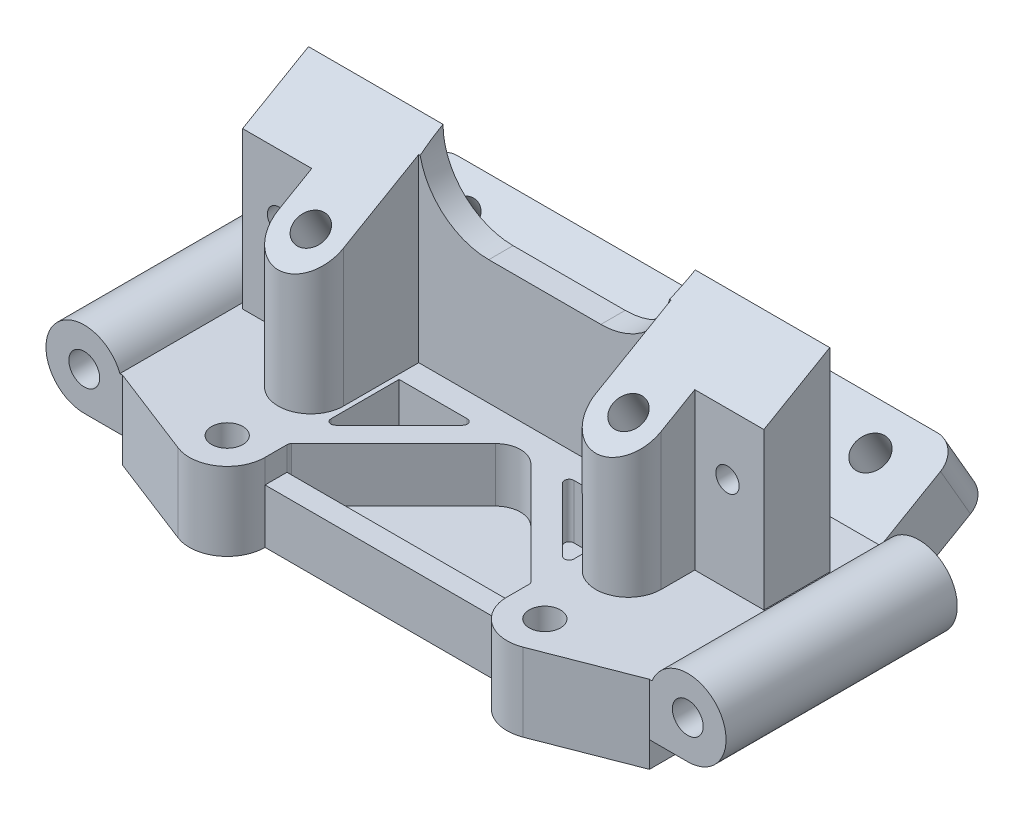
from build123d import *

# Parameters (mm, degrees)
SKETCH1_R           = 1.675
BOSS_EXTRUDE1_DEPTH = 8.35
SKETCH2_R           = 1.65
BOSS_EXTRUDE2_DEPTH = 24.75
BOSS_EXTRUDE3_DEPTH = 20.8
CUT_EXTRUDE1_DEPTH  = 50.573909469
CUT_EXTRUDE2_DEPTH  = 53.287713662
SKETCH6_R           = 1.675
CUT_EXTRUDE3_DEPTH  = 10
SKETCH7_R           = 1.25
CUT_EXTRUDE4_DEPTH  = 53.287713662
CUT_EXTRUDE5_DEPTH  = 5.8
SKETCH9_W           = 12.95
SKETCH9_H           = 2.348780669
BOSS_EXTRUDE4_DEPTH = 3.24
BOSS_EXTRUDE5_DEPTH = 28.2
FILLET1_R           = 2.5
SKETCH11_R          = 1.75
CUT_EXTRUDE6_DEPTH  = 6.411671601
CUT_EXTRUDE7_DEPTH  = 3.13
CUT_EXTRUDE8_REACH  = 61.109
SKETCH13_W          = 15.68
SKETCH13_H          = 5


with BuildPart() as part:
    # Sketch1 → Boss-Extrude1 (new body)
    with BuildSketch(Plane(origin=(0, 0, 0), x_dir=(1, 0, 0), z_dir=(0, 1, 0))):
        with BuildLine():
            Line((28.2, 0), (0, 0))
            Line((0, 0), (0, -24.75))
            Line((0, -24.75), (12.95, -24.75))
            ThreePointArc((12.95, -24.75), (14.711852404, -28.091688283), (18.464508929, -28.52593877))
            Line((18.464508929, -28.52593877), (28.2, -24.75))
            Line((28.2, -24.75), (28.2, 0))
        make_face()
        with Locations(Location((17, -24.75, 0), (0, 0, 270))):
            Circle(SKETCH1_R, mode=Mode.SUBTRACT)
        with Locations(Location((17, -9.75, 0), (0, 0, 270))):
            Circle(SKETCH1_R, mode=Mode.SUBTRACT)
    extrude(amount=BOSS_EXTRUDE1_DEPTH)

    # Sketch2 → Boss-Extrude2 (add)
    with BuildSketch(Plane(origin=(0, 0, 0), x_dir=(-1, 0, 0), z_dir=(0, 0, -1))):
        with BuildLine():
            Line((-32.3, 2.75), (-28.2, 2.75))
            Line((-28.2, 2.75), (-28.2, 8.35))
            Line((-28.2, 8.35), (-28.484243194, 8.35))
            ThreePointArc((-28.484243194, 8.35), (-35.688214869, 9.158679276), (-32.3, 2.75))
        make_face()
        with Locations((-32.3, 6.85)):
            Circle(SKETCH2_R, mode=Mode.SUBTRACT)
    extrude(amount=-BOSS_EXTRUDE2_DEPTH)

    # Sketch3 → Boss-Extrude3 (add)
    with BuildSketch(Plane(origin=(0, 8.35, 0), x_dir=(1, 0, 0), z_dir=(0, 1, 0))):
        with BuildLine():
            Line((27.9, -5.15), (0, -5.15))
            Line((0, -5.15), (0, -7.75))
            Line((0, -7.75), (13.5, -7.75))
            Line((13.5, -7.75), (13.5, -15.8))
            ThreePointArc((13.5, -15.8), (17, -19.3), (20.5, -15.8))
            Line((20.5, -15.8), (20.5, -12.2))
            Line((20.5, -12.2), (27.9, -12.2))
            Line((27.9, -12.2), (27.9, -5.15))
        make_face()
    extrude(amount=BOSS_EXTRUDE3_DEPTH)

    # Sketch4 → Cut-Extrude1 (cut, through all)
    with BuildSketch(Plane(origin=(27.9, 0, 0), x_dir=(0, 0, -1), z_dir=(1, 0, 0))):
        Polygon((-5.15, 29.15), (-19.3, 20.980493691), (-19.3, 29.15), align=None)
    extrude(amount=-CUT_EXTRUDE1_DEPTH, mode=Mode.SUBTRACT)

    # Sketch5 → Cut-Extrude2 (cut, through all)
    with BuildSketch(Plane(origin=(0, 0, 5.15), x_dir=(-1, 0, 0), z_dir=(0, 0, -1))):
        with BuildLine():
            Line((-6, 21.65), (0, 21.65))
            Line((0, 21.65), (0, 29.15))
            Line((0, 29.15), (-13.5, 29.15))
            ThreePointArc((-13.5, 29.15), (-11.303300859, 23.846699141), (-6, 21.65))
        make_face()
    extrude(amount=-CUT_EXTRUDE2_DEPTH, mode=Mode.SUBTRACT)

    # Sketch6 → Cut-Extrude3 (cut)
    with BuildSketch(Plane(origin=(0, 24.092515415, 13.90982026), x_dir=(1, 0, 0), z_dir=(0, 0.8660254037844362, 0.5000000000000046))):
        with Locations(Location((17, -2.182591563, 0), (0, 0, 270))):
            Circle(SKETCH6_R)
    extrude(amount=-CUT_EXTRUDE3_DEPTH, mode=Mode.SUBTRACT)

    # Sketch7 → Cut-Extrude4 (cut, through all)
    with BuildSketch(Plane(origin=(0, 0, 5.15), x_dir=(-1, 0, 0), z_dir=(0, 0, -1))):
        with Locations((-24, 18.5)):
            Circle(SKETCH7_R)
    extrude(amount=-CUT_EXTRUDE4_DEPTH, mode=Mode.SUBTRACT)

    # Sketch8 → Cut-Extrude5 (cut)
    with BuildSketch(Plane(origin=(0, 8.35, 0), x_dir=(1, 0, 0), z_dir=(0, 1, 0))):
        with BuildLine():
            Line((13, -10.35), (13, -17.642893219))
            ThreePointArc((13, -17.642893219), (12.691341716, -18.104832985), (12.146446609, -17.996446609))
            Line((12.146446609, -17.996446609), (5.353553391, -11.203553391))
            ThreePointArc((5.353553391, -11.203553391), (5.245167015, -10.658658284), (5.707106781, -10.35))
            Line((5.707106781, -10.35), (13, -10.35))
        make_face()
        with BuildLine():
            Line((1.887867966, -11.131980515), (12.803553391, -22.04766594))
            ThreePointArc((12.803553391, -22.04766594), (12.911939766, -22.209877615), (12.95, -22.401219331))
            Line((12.95, -22.401219331), (12.95, -24.75))
            Line((12.95, -24.75), (0, -24.75))
            Line((0, -24.75), (0, -10.35))
            ThreePointArc((0, -10.35), (1.021706781, -10.553230114), (1.887867966, -11.131980515))
        make_face()
    extrude(amount=-CUT_EXTRUDE5_DEPTH, mode=Mode.SUBTRACT)

    # Sketch9 → Boss-Extrude4 (add)
    with BuildSketch(Plane(origin=(0, 2.55, 0), x_dir=(1, 0, 0), z_dir=(0, 1, 0))):
        with Locations((6.475, -23.575609666)):
            Rectangle(SKETCH9_W, SKETCH9_H)
    extrude(amount=BOSS_EXTRUDE4_DEPTH)

    # Sketch10 → Boss-Extrude5 (add)
    with BuildSketch(Plane.ZY):
        Polygon((0, 8.35), (-8.569597977, 13.297659699), (-11.775433778, 7.744989211), (-3.11517974, 2.744989211), (-4.7, 0), (0, 0), align=None)
    extrude(amount=-BOSS_EXTRUDE5_DEPTH)

    # Fillet1
    fillet1_edges = [part.edges().sort_by_distance(p)[0] for p in [
        (28.2, 10.521324455, -10.172515877),
    ]]
    fillet(fillet1_edges, radius=FILLET1_R)

    # Sketch11 → Cut-Extrude6 (cut)
    with BuildSketch(Plane(origin=(0, 0.709829513, 0.40982026), x_dir=(1, 0, 0), z_dir=(0, -0.8660254037844389, -0.4999999999999994))):
        with Locations((0, -10.070319398)):
            Circle(SKETCH11_R)
        with Locations(Location((22, -10.070319398, 0), (0, 0, 270))):
            Circle(SKETCH11_R)
    extrude(amount=-CUT_EXTRUDE6_DEPTH, mode=Mode.SUBTRACT)

    # Sketch12 → Cut-Extrude7 (cut)
    with BuildSketch(Plane(origin=(0, 0.709829513, 0.40982026), x_dir=(1, 0, 0), z_dir=(0, -0.8660254037844389, -0.4999999999999994))):
        with BuildLine():
            Line((19.935417718, -6.470319398), (2.064582282, -6.470319398))
            ThreePointArc((2.064582282, -6.470319398), (3.929893445, -8.736738687), (3.8291644, -11.670319398))
            Line((3.8291644, -11.670319398), (18.1708356, -11.670319398))
            ThreePointArc((18.1708356, -11.670319398), (18.070106555, -8.736738687), (19.935417718, -6.470319398))
        make_face()
    extrude(amount=-CUT_EXTRUDE7_DEPTH, mode=Mode.SUBTRACT)

    # Cut-Extrude8: up to this plane
    cut_extrude8_end = Plane(origin=(0, 29.15, 5.15), z_dir=(0, 0, -1))
    # Sketch13 → Cut-Extrude8 (cut, up to the surface)
    with BuildSketch(Plane(origin=(0, 7.035159699, -12.185254038), x_dir=(-1, 0, 0), z_dir=(0, 0.4999999999999996, -0.8660254037844388)), mode=Mode.PRIVATE) as cut_extrude8_sk1:
        with Locations((-10.84, 9.731312122)):
            Rectangle(SKETCH13_W, SKETCH13_H)
    cut_extrude8_tool1 = split(extrude(cut_extrude8_sk1.sketch, amount=-CUT_EXTRUDE8_REACH, mode=Mode.PRIVATE), bisect_by=cut_extrude8_end, keep=Keep.BOTH, mode=Mode.PRIVATE)
    add(cut_extrude8_tool1.solids().sort_by_distance((10.84, 15.462723, -7.319598))[0], mode=Mode.SUBTRACT)

    # Mirror1: part across plane


with BuildPart() as part_1:
    add(part.part)
    add(part.part.mirror(Plane(origin=(0, 8.35, 24.75), x_dir=(0, 0, 1), z_dir=(1, 0, 0))))


solid = part_1.part
